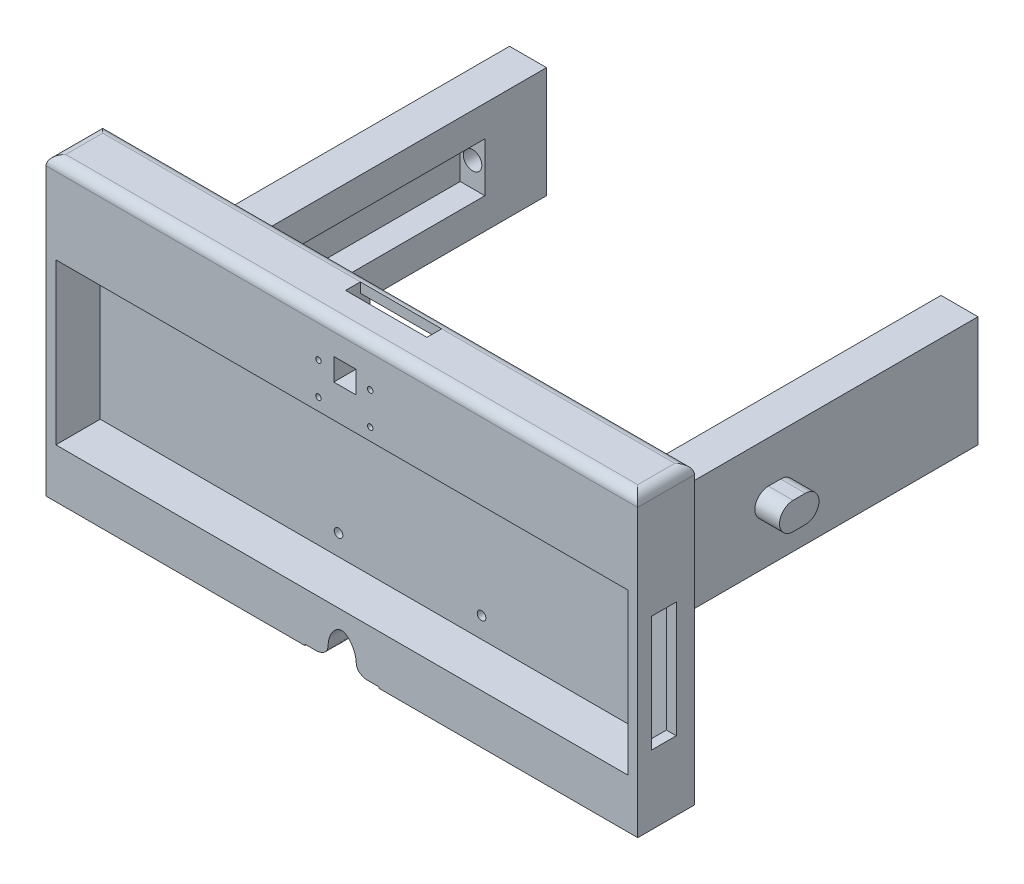
from build123d import *

# Parameters (mm, degrees)
ESQUISSE1_W              = 240
ESQUISSE1_H              = 120
BOSS_EXTRU_1_DEPTH       = 23
ESQUISSE2_W              = 232
ESQUISSE2_H              = 65
ENL_V_MAT_EXTRU_1_DEPTH  = 18
CONG_1_R                 = 4
ESQUISSE7_R              = 1.75
ENL_V_MAT_EXTRU_3_DEPTH  = 10
ESQUISSE14_W             = 10
ESQUISSE14_H             = 47
ENL_V_MAT_EXTRU_9_DEPTH  = 43
ESQUISSE17_W             = 33
ESQUISSE17_H             = 6
ENL_V_MAT_EXTRU_11_DEPTH = 32
ESQUISSE18_W             = 33
ESQUISSE18_H             = 28
ENL_V_MAT_EXTRU_12_DEPTH = 7
ESQUISSE19_W             = 15
ESQUISSE19_H             = 45
BOSS_EXTRU_2_DEPTH       = 140
ESQUISSE20_W             = 100
ESQUISSE20_H             = 20
ENL_V_MAT_EXTRU_13_DEPTH = 10
ESQUISSE21_R             = 3.75
ENL_V_MAT_EXTRU_14_DEPTH = 40
ESQUISSE22_W             = 100
ESQUISSE22_H             = 20
ENL_V_MAT_EXTRU_15_DEPTH = 10
ESQUISSE23_R             = 3.75
ENL_V_MAT_EXTRU_16_DEPTH = 40
BOSS_EXTRU_3_DEPTH       = 10
BOSS_EXTRU_4_START       = 10
BOSS_EXTRU_4_DEPTH       = 10
ESQUISSE30_R             = 1.1
ESQUISSE30_W             = 9
ESQUISSE30_H             = 9
ENL_V_MAT_EXTRU_22_DEPTH = 30
ESQUISSE31_W             = 6
ESQUISSE31_H             = 3
ENL_V_MAT_EXTRU_23_DEPTH = 10
ENL_V_MAT_EXTRU_24_DEPTH = 40


with BuildPart() as part:
    # Esquisse1 → Boss.-Extru.1 (new body)
    with BuildSketch(Plane.XY):
        with Locations((-120, -60)):
            Rectangle(ESQUISSE1_W, ESQUISSE1_H)
    extrude(amount=BOSS_EXTRU_1_DEPTH)

    # Esquisse2 → Enlèv. mat.-Extru.1 (cut)
    with BuildSketch(Plane.XY.offset(23)):
        with Locations((-120, -67.5)):
            Rectangle(ESQUISSE2_W, ESQUISSE2_H)
    extrude(amount=-ENL_V_MAT_EXTRU_1_DEPTH, mode=Mode.SUBTRACT)

    # Congé1
    cong_1_edges = [part.edges().sort_by_distance(p)[0] for p in [
        (-120, 0, 0),
        (-240, 0, 11.5),
        (0, 0, 11.5),
        (-120, 0, 23),
    ]]
    fillet(cong_1_edges, radius=CONG_1_R)

    # Esquisse7 → Enlèv. mat.-Extru.3 (cut)
    with BuildSketch(Plane.XY.offset(5)):
        with Locations((-139.35, -42.66)):
            Circle(ESQUISSE7_R)
        with Locations((-139.35, -91.66)):
            Circle(ESQUISSE7_R)
        with Locations((-81.35, -91.66)):
            Circle(ESQUISSE7_R)
        with Locations((-81.35, -42.66)):
            Circle(ESQUISSE7_R)
    extrude(amount=-ENL_V_MAT_EXTRU_3_DEPTH, mode=Mode.SUBTRACT)

    # Esquisse14 → Enlèv. mat.-Extru.9 (cut)
    with BuildSketch(Plane.ZY.offset(4)):
        with Locations((12.363440201, -68.5)):
            Rectangle(ESQUISSE14_W, ESQUISSE14_H)
    extrude(amount=-ENL_V_MAT_EXTRU_9_DEPTH, mode=Mode.SUBTRACT)

    # Esquisse17 → Enlèv. mat.-Extru.11 (cut)
    with BuildSketch(Plane(origin=(0, 0, 0), x_dir=(1, 0, 0), z_dir=(0, 1, 0))):
        with Locations((-115, -7)):
            Rectangle(ESQUISSE17_W, ESQUISSE17_H)
    extrude(amount=-ENL_V_MAT_EXTRU_11_DEPTH, mode=Mode.SUBTRACT)

    # Esquisse18 → Enlèv. mat.-Extru.12 (cut)
    with BuildSketch(Plane(origin=(0, 0, 0), x_dir=(-1, 0, 0), z_dir=(0, 0, -1))):
        with Locations((115, -18)):
            Rectangle(ESQUISSE18_W, ESQUISSE18_H)
    extrude(amount=-ENL_V_MAT_EXTRU_12_DEPTH, mode=Mode.SUBTRACT)

    # Esquisse19 → Boss.-Extru.2 (add)
    with BuildSketch(Plane(origin=(0, 0, 0), x_dir=(-1, 0, 0), z_dir=(0, 0, -1))):
        with Locations((32.5, -53.5)):
            Rectangle(ESQUISSE19_W, ESQUISSE19_H)
        with Locations((207.5, -53.5)):
            Rectangle(ESQUISSE19_W, ESQUISSE19_H)
    extrude(amount=BOSS_EXTRU_2_DEPTH)

    # Esquisse20 → Enlèv. mat.-Extru.13 (cut)
    with BuildSketch(Plane.ZY.offset(40)):
        with Locations((-65, -53.5)):
            Rectangle(ESQUISSE20_W, ESQUISSE20_H)
    extrude(amount=-ENL_V_MAT_EXTRU_13_DEPTH, mode=Mode.SUBTRACT)

    # Esquisse21 → Enlèv. mat.-Extru.14 (cut)
    with BuildSketch(Plane.XY.offset(-115)):
        with Locations((-35, -53.5)):
            Circle(ESQUISSE21_R)
    extrude(amount=-ENL_V_MAT_EXTRU_14_DEPTH, mode=Mode.SUBTRACT)

    # Esquisse22 → Enlèv. mat.-Extru.15 (cut)
    with BuildSketch(Plane(origin=(-200, 0, 0), x_dir=(0, 0, -1), z_dir=(1, 0, 0))):
        with Locations((65, -53.5)):
            Rectangle(ESQUISSE22_W, ESQUISSE22_H)
    extrude(amount=-ENL_V_MAT_EXTRU_15_DEPTH, mode=Mode.SUBTRACT)

    # Esquisse23 → Enlèv. mat.-Extru.16 (cut)
    with BuildSketch(Plane.XY.offset(-115)):
        with Locations((-205, -53.5)):
            Circle(ESQUISSE23_R)
    extrude(amount=-ENL_V_MAT_EXTRU_16_DEPTH, mode=Mode.SUBTRACT)

    # Esquisse25 → Boss.-Extru.3 (add)
    with BuildSketch(Plane(origin=(-25, 0, 0), x_dir=(0, 0, -1), z_dir=(1, 0, 0))):
        with BuildLine():
            Line((55, -48), (60, -48))
            ThreePointArc((60, -48), (65.5, -53.5), (60, -59))
            Line((60, -59), (55, -59))
            ThreePointArc((55, -59), (49.5, -53.5), (55, -48))
        make_face()
    extrude(amount=BOSS_EXTRU_3_DEPTH)

    # Esquisse26 → Boss.-Extru.4 (add)
    with BuildSketch(Plane.ZY.offset(215).offset(BOSS_EXTRU_4_START)):
        with BuildLine():
            Line((-60, -48), (-55, -48))
            ThreePointArc((-55, -48), (-49.5, -53.5), (-55, -59))
            Line((-55, -59), (-60, -59))
            ThreePointArc((-60, -59), (-65.5, -53.5), (-60, -48))
        make_face()
    extrude(amount=-BOSS_EXTRU_4_DEPTH)

    # Esquisse30 → Enlèv. mat.-Extru.22 (cut)
    with BuildSketch(Plane(origin=(0, 0, 10), x_dir=(-1, 0, 0), z_dir=(0, 0, -1))):
        with Locations((108.5, -30)):
            Circle(ESQUISSE30_R)
        with Locations((129.5, -30)):
            Circle(ESQUISSE30_R)
        with Locations((129.5, -16.96)):
            Circle(ESQUISSE30_R)
        with Locations((108.5, -16.96)):
            Circle(ESQUISSE30_R)
        with Locations((118.79, -17.08)):
            Rectangle(ESQUISSE30_W, ESQUISSE30_H)
    extrude(amount=-ENL_V_MAT_EXTRU_22_DEPTH, mode=Mode.SUBTRACT)

    # Esquisse31 → Enlèv. mat.-Extru.23 (cut)
    with BuildSketch(Plane.XY.offset(5)):
        with Locations((-91.35, -42.5)):
            Rectangle(ESQUISSE31_W, ESQUISSE31_H)
    extrude(amount=-ENL_V_MAT_EXTRU_23_DEPTH, mode=Mode.SUBTRACT)

    # Esquisse32 → Enlèv. mat.-Extru.24 (cut)
    with BuildSketch(Plane.XY.offset(23)):
        with BuildLine():
            Line((-135, -119.5), (-135, -120))
            Line((-135, -120), (-105, -120))
            Line((-105, -120), (-105, -119.5))
            Line((-105, -119.5), (-110, -119.5))
            add(Edge.make_bspline(
                [(-130, -119.5), (-129.411520636, -119.5), (-125.206007881, -118.2698291), (-126.070515277, -112.049296748), (-119.869966777, -103.868703164), (-113.838690693, -112.386692695), (-114.398901471, -118.075641111), (-110.922134696, -119.5), (-110, -119.5)],
                knots=[0, 0, 0, 0, 0.144122834, 0.276784549, 0.509496521, 0.778688307, 0.880905797, 1, 1, 1, 1], degree=3))
            Line((-130, -119.5), (-135, -119.5))
        make_face()
    extrude(amount=-ENL_V_MAT_EXTRU_24_DEPTH, mode=Mode.SUBTRACT)


solid = part.part
